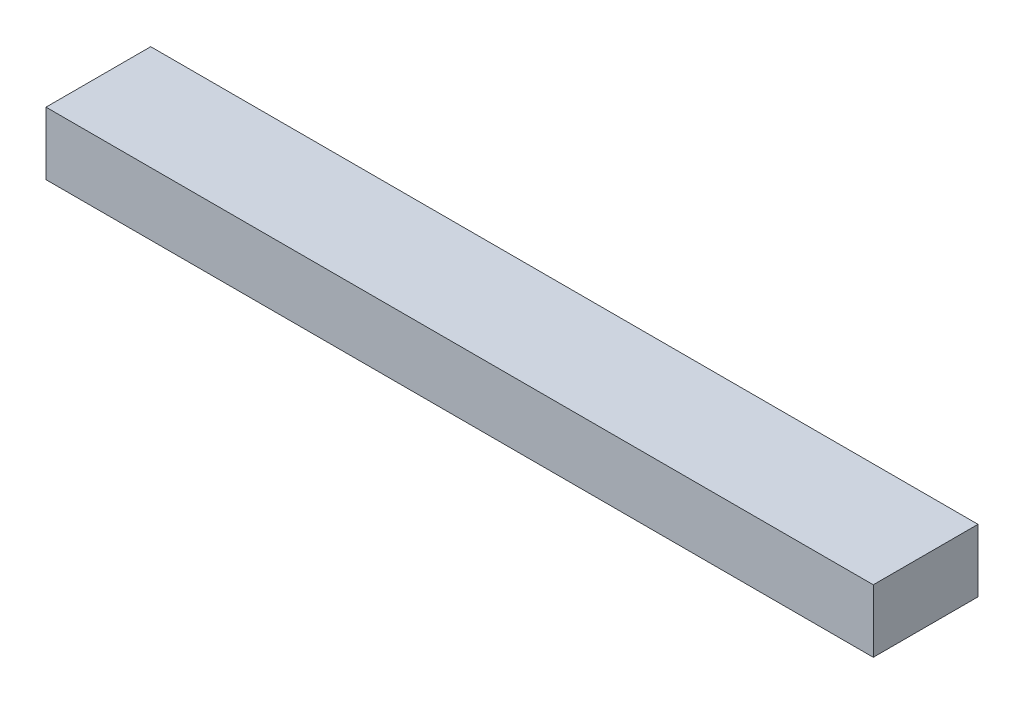
from build123d import *

# Parameters (mm, degrees)
SKETCH1_W           = 79
SKETCH1_H           = 10
BOSS_EXTRUDE1_DEPTH = 6


with BuildPart() as part:
    # Sketch1 → Boss-Extrude1 (new body)
    with BuildSketch(Plane(origin=(0, 0, 0), x_dir=(1, 0, 0), z_dir=(0, 1, 0))):
        with Locations((39.5, -15)):
            Rectangle(SKETCH1_W, SKETCH1_H)
    extrude(amount=BOSS_EXTRUDE1_DEPTH)


solid = part.part
